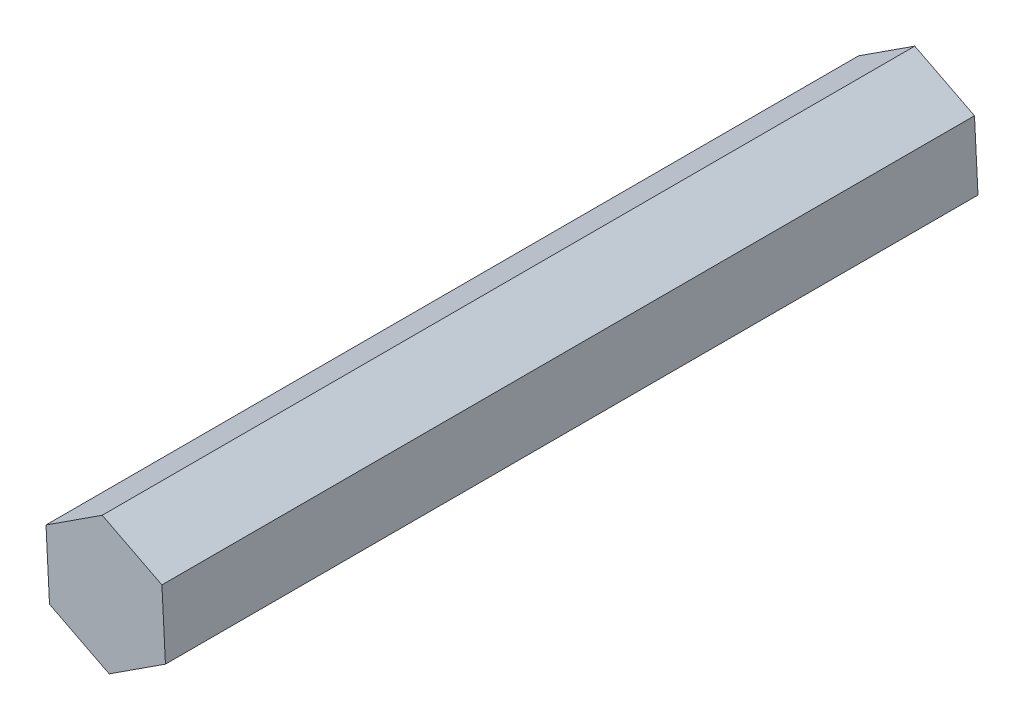
from build123d import *

# Parameters (mm, degrees)
BOSS_EXTRUDE2_DEPTH = 88.9


with BuildPart() as part:
    # Sketch2 → Boss-Extrude2 (new body)
    with BuildSketch(Plane.XY):
        Polygon((-6.532932597, 3.329282958), (-6.149709917, -3.993044111), (0.38322268, -7.322327069), (6.532932597, -3.329282958), (6.149709917, 3.993044111), (-0.38322268, 7.322327069), align=None)
    extrude(amount=BOSS_EXTRUDE2_DEPTH)


solid = part.part
